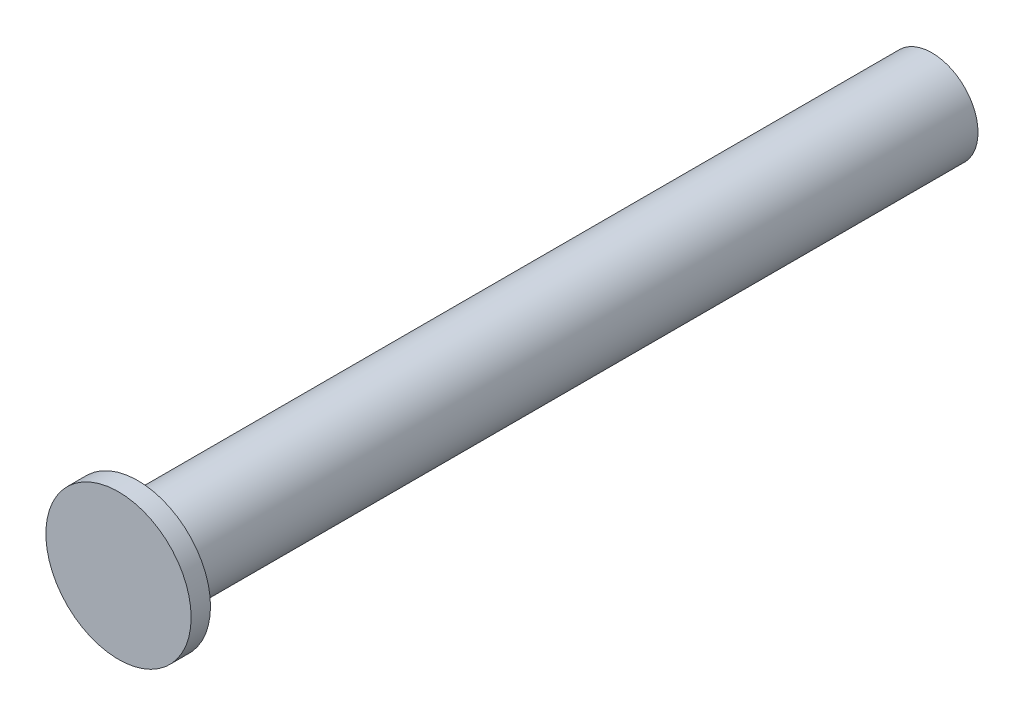
from build123d import *

# Parameters (mm, degrees)
SKETCH_1_R      = 4.75
EXTRUDE_1_DEPTH = 82
SKETCH_2_R      = 7.5
EXTRUDE_2_DEPTH = 2


with BuildPart() as part:
    # 草图1 → 凸台-拉伸1 (new body)
    with BuildSketch(Plane.XY):
        Circle(SKETCH_1_R)
    extrude(amount=EXTRUDE_1_DEPTH)

    # 草图2 → 凸台-拉伸2 (add)
    with BuildSketch(Plane.XY.offset(82)):
        Circle(SKETCH_2_R)
    extrude(amount=EXTRUDE_2_DEPTH)


solid = part.part
